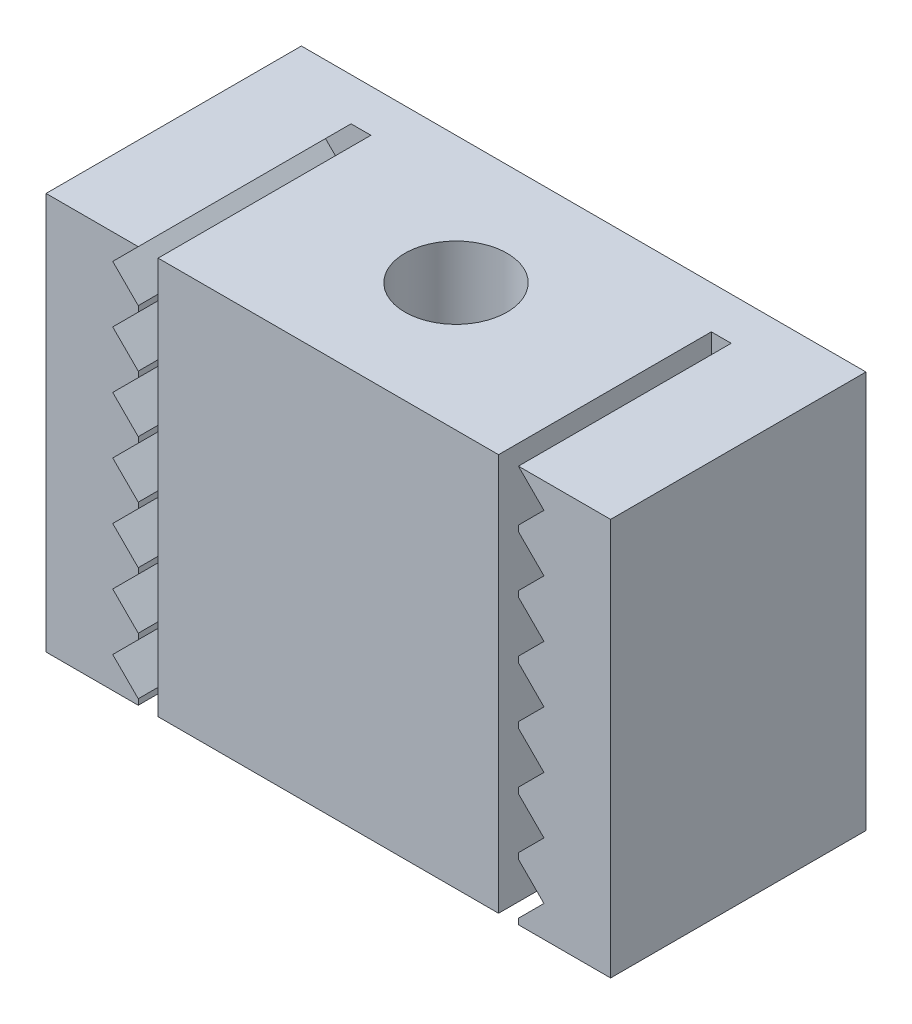
from build123d import *

# Parameters (mm, degrees)
SKETCH1_W           = 19.9
SKETCH1_H           = 14
BOSS_EXTRUDE1_DEPTH = 9
SKETCH2_R           = 1.8
CUT_EXTRUDE1_DEPTH  = 20.390783893
CUT_EXTRUDE2_DEPTH  = 7.5


with BuildPart() as part:
    # Sketch1 → Boss-Extrude1 (new body)
    with BuildSketch(Plane.XY):
        with Locations((0, 7)):
            Rectangle(SKETCH1_W, SKETCH1_H)
    extrude(amount=BOSS_EXTRUDE1_DEPTH)

    # Sketch2 → Cut-Extrude1 (cut, through all)
    with BuildSketch(Plane(origin=(0, 14, 0), x_dir=(1, 0, 0), z_dir=(0, 1, 0))):
        with Locations(Location((0, -4.5, 0), (0, 0, 270))):
            Circle(SKETCH2_R)
    extrude(amount=-CUT_EXTRUDE1_DEPTH, mode=Mode.SUBTRACT)

    # Sketch3 → Cut-Extrude2 (cut)
    with BuildSketch(Plane.XY.offset(9)):
        Polygon((6, 14), (6, 0), (6.7, 0), (6.7, 0.2), (7.6, 1.1), (6.7, 2), (6.7, 2.2), (7.6, 3.1), (6.7, 4), (6.7, 4.2), (7.6, 5.1), (6.7, 6), (6.7, 6.2), (7.6, 7.1), (6.7, 8), (6.7, 8.2), (7.6, 9.1), (6.7, 10), (6.7, 10.2), (7.6, 11.1), (6.7, 12), (6.7, 12.2), (7.6, 13.1), (6.7, 14), align=None)
        Polygon((-6.7, 0.2), (-6.7, 0), (-6, 0), (-6, 14), (-6.7, 14), (-7.6, 13.1), (-6.7, 12.2), (-6.7, 12), (-7.6, 11.1), (-6.7, 10.2), (-6.7, 10), (-7.6, 9.1), (-6.7, 8.2), (-6.7, 8), (-7.6, 7.1), (-6.7, 6.2), (-6.7, 6), (-7.6, 5.1), (-6.7, 4.2), (-6.7, 4), (-7.6, 3.1), (-6.7, 2.2), (-6.7, 2), (-7.6, 1.1), align=None)
    extrude(amount=-CUT_EXTRUDE2_DEPTH, mode=Mode.SUBTRACT)


solid = part.part
